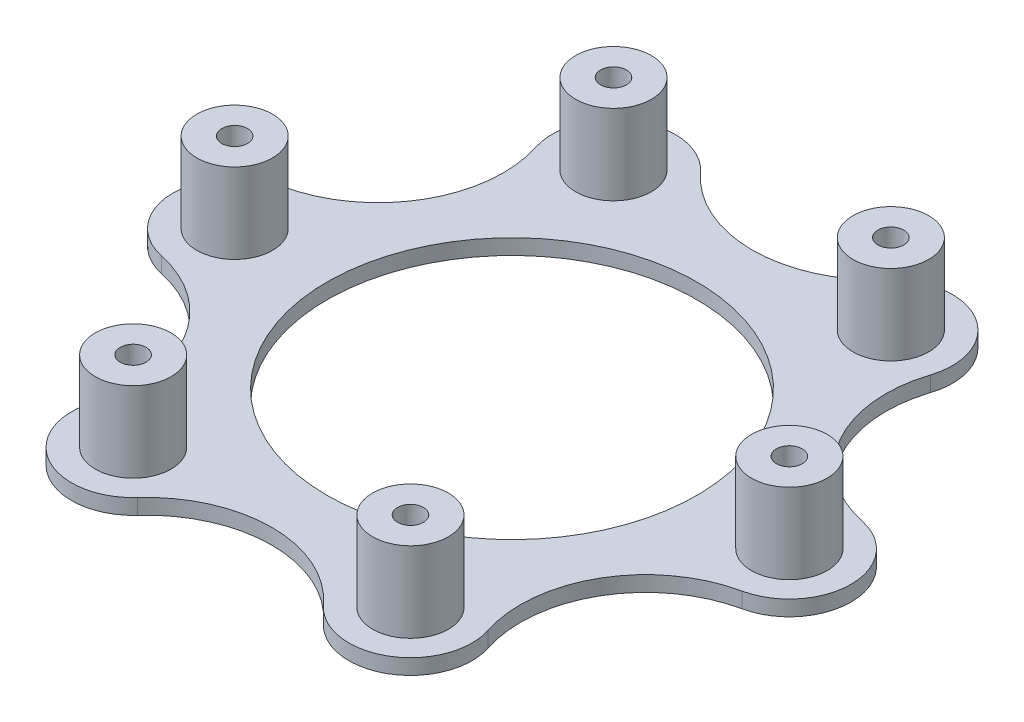
from build123d import *

# Parameters (mm, degrees)
EXTRUDE_1_DEPTH     = 2.5
SKETCH_3_R          = 2.1
SKETCH_3_R_2        = 30
CUT_EXTRUDE_1_DEPTH = 2.5
EXTRUDE_START       = 13
SKETCH_4_R          = 6.15
SKETCH_4_R_2        = 2.1
EXTRUDE_2_DEPTH     = 13


with BuildPart() as part:
    # 草图2 → 凸台-拉伸1 (new body)
    with BuildSketch(Plane(origin=(0, 0, 0), x_dir=(1, 0, 0), z_dir=(0, 1, 0))):
        with BuildLine():
            ThreePointArc((32.014603848, -35.893430769), (33.749999498, -19.485572455), (47.091922833, -9.77874526))
            ThreePointArc((47.091922833, -9.77874526), (55, 8.44e-07), (47.091921183, 9.778745613))
            ThreePointArc((47.091921183, 9.778745613), (33.749999557, 19.485572352), (32.014603255, 35.893428936))
            ThreePointArc((32.014603255, 35.893428936), (27.499999447, 47.631397528), (15.077318804, 45.67217323))
            ThreePointArc((15.077318804, 45.67217323), (-6.08e-07, 38.97114317), (-15.077319619, 45.672174133))
            ThreePointArc((-15.077319619, 45.672174133), (-27.500000167, 47.631397112), (-32.014603117, 35.893428511))
            ThreePointArc((-32.014603117, 35.893428511), (-33.750000135, 19.485571351), (-47.091923006, 9.778745223))
            ThreePointArc((-47.091923006, 9.778745223), (-55, 1.241e-06), (-47.091925432, -9.778744704))
            ThreePointArc((-47.091925432, -9.778744704), (-33.7500007, -19.485570372), (-32.014603185, -35.89342872))
            ThreePointArc((-32.014603185, -35.89342872), (-27.500001103, -47.631396571), (-15.077321215, -45.672175901))
            ThreePointArc((-15.077321215, -45.672175901), (-1.245e-06, -38.97114317), (15.077319547, -45.672174053))
            ThreePointArc((15.077319547, -45.672174053), (27.499999092, -47.631397732), (32.014603848, -35.893430769))
        make_face()
    extrude(amount=EXTRUDE_1_DEPTH)

    # 草图3 → 切除-拉伸1 (cut)
    with BuildSketch(Plane(origin=(0, 2.5, 0), x_dir=(1, 0, 0), z_dir=(0, 1, 0))):
        with Locations(Location((-22.5, 38.97114317, 0), (0, 0, 270))):
            Circle(SKETCH_3_R)
        with Locations(Location((22.5, 38.97114317, 0), (0, 0, 270))):
            Circle(SKETCH_3_R)
        with Locations(Location((45, 0, 0), (0, 0, 270))):
            Circle(SKETCH_3_R)
        with Locations(Location((22.5, -38.97114317, 0), (0, 0, 270))):
            Circle(SKETCH_3_R)
        with Locations(Location((-22.5, -38.97114317, 0), (0, 0, 270))):
            Circle(SKETCH_3_R)
        with Locations(Location((-45, 0, 0), (0, 0, 270))):
            Circle(SKETCH_3_R)
        with Locations(Location((0, 0, 0), (0, 0, 270))):
            Circle(SKETCH_3_R_2)
    extrude(amount=-CUT_EXTRUDE_1_DEPTH, mode=Mode.SUBTRACT)

    # 草图4 → 凸台-拉伸2 (add)
    # profile 1 of 6: a face of its own
    with BuildSketch(Plane(origin=(0, 2.5, 0), x_dir=(1, 0, 0), z_dir=(0, 1, 0)).offset(EXTRUDE_START)):
        with Locations(Location((-22.5, 38.97114317, 0), (0, 0, 90))):
            Circle(SKETCH_4_R)
        with Locations(Location((-22.5, 38.97114317, 0), (0, 0, 270))):
            Circle(SKETCH_4_R_2, mode=Mode.SUBTRACT)
    # profile 2 of 6: a face of its own
    with BuildSketch(Plane(origin=(0, 2.5, 0), x_dir=(1, 0, 0), z_dir=(0, 1, 0)).offset(EXTRUDE_START)):
        with Locations(Location((22.5, 38.97114317, 0), (0, 0, 90))):
            Circle(SKETCH_4_R)
        with Locations(Location((22.5, 38.97114317, 0), (0, 0, 270))):
            Circle(SKETCH_4_R_2, mode=Mode.SUBTRACT)
    # profile 3 of 6: a face of its own
    with BuildSketch(Plane(origin=(0, 2.5, 0), x_dir=(1, 0, 0), z_dir=(0, 1, 0)).offset(EXTRUDE_START)):
        with Locations(Location((45, 0, 0), (0, 0, 90))):
            Circle(SKETCH_4_R)
        with Locations(Location((45, 0, 0), (0, 0, 270))):
            Circle(SKETCH_4_R_2, mode=Mode.SUBTRACT)
    # profile 4 of 6: a face of its own
    with BuildSketch(Plane(origin=(0, 2.5, 0), x_dir=(1, 0, 0), z_dir=(0, 1, 0)).offset(EXTRUDE_START)):
        with Locations(Location((22.5, -38.97114317, 0), (0, 0, 90))):
            Circle(SKETCH_4_R)
        with Locations(Location((22.5, -38.97114317, 0), (0, 0, 270))):
            Circle(SKETCH_4_R_2, mode=Mode.SUBTRACT)
    # profile 5 of 6: a face of its own
    with BuildSketch(Plane(origin=(0, 2.5, 0), x_dir=(1, 0, 0), z_dir=(0, 1, 0)).offset(EXTRUDE_START)):
        with Locations(Location((-22.5, -38.97114317, 0), (0, 0, 90))):
            Circle(SKETCH_4_R)
        with Locations(Location((-22.5, -38.97114317, 0), (0, 0, 270))):
            Circle(SKETCH_4_R_2, mode=Mode.SUBTRACT)
    # profile 6 of 6: a face of its own
    with BuildSketch(Plane(origin=(0, 2.5, 0), x_dir=(1, 0, 0), z_dir=(0, 1, 0)).offset(EXTRUDE_START)):
        with Locations(Location((-45, 0, 0), (0, 0, 90))):
            Circle(SKETCH_4_R)
        with Locations(Location((-45, 0, 0), (0, 0, 270))):
            Circle(SKETCH_4_R_2, mode=Mode.SUBTRACT)
    extrude(amount=-EXTRUDE_2_DEPTH)


solid = part.part
